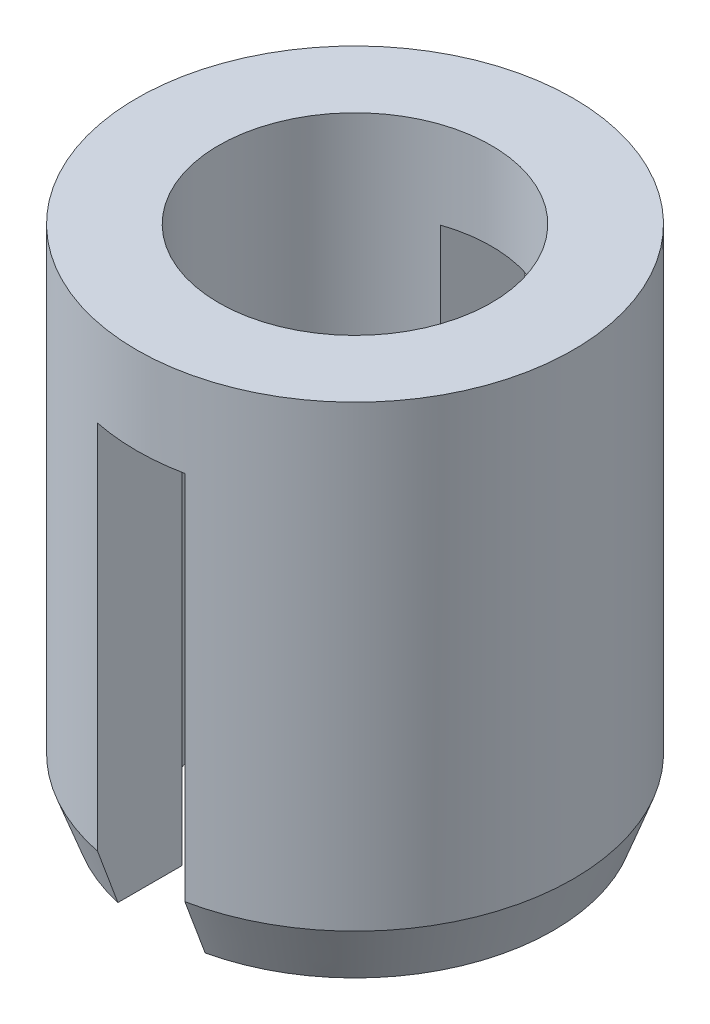
from build123d import *

# Parameters (mm, degrees)
M3_TAPPED_HOLE1_D       = 2.5
CUT_EXTRUDE1_DEPTH      = 6.485435261
CUT_EXTRUDE1_DEPTH_BACK = 6.485435261
SKETCH2_W               = 0.8
SKETCH2_H               = 3.9


with BuildPart() as part:
    # Sketch1 → Revolve1 (revolve)
    with BuildSketch(Plane.XY, mode=Mode.PRIVATE) as revolve1_sk:
        Polygon((0, -4.7), (0, 0), (-2, 0), (-2, -4.2), (-1.818014883, -4.7), align=None)
    revolve(revolve1_sk.sketch.rotate(Axis((0, -4.7, 0), (0, -1, 0)), 270), axis=Axis((0, -4.7, 0), (0, -1, 0)))

    # M3 Tapped Hole1 (through all)
    with Locations(Plane(origin=(0, 0, 0), x_dir=(1, 0, 0), z_dir=(0, 1, 0))):
        with Locations((0, 0)):
            Hole(M3_TAPPED_HOLE1_D / 2)

    # Sketch2 → Cut-Extrude1 (cut, two sides: drawn at the far end of the back side and taken through both)
    with BuildSketch(Plane.XY.offset(-CUT_EXTRUDE1_DEPTH_BACK)):
        with Locations((0, -2.75)):
            Rectangle(SKETCH2_W, SKETCH2_H)
    extrude(amount=CUT_EXTRUDE1_DEPTH + CUT_EXTRUDE1_DEPTH_BACK, mode=Mode.SUBTRACT)


solid = part.part
